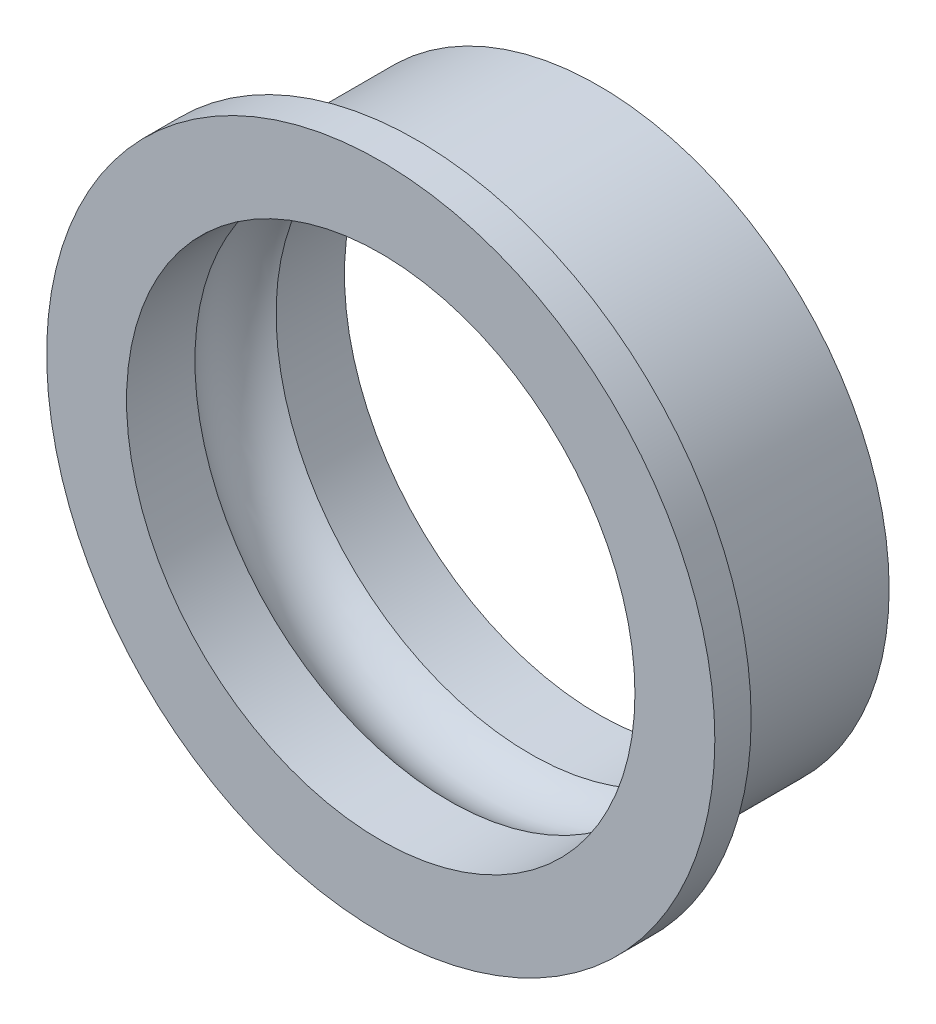
from build123d import *

# Parameters (mm, degrees)
ESQUISSE1_R        = 4
ESQUISSE1_R_2      = 3.5
BOSS_EXTRU_1_DEPTH = 1.5
ESQUISSE2_R        = 4.6
ESQUISSE2_R_2      = 4
BOSS_EXTRU_2_DEPTH = 0.5


with BuildPart() as part:
    # Esquisse1 → Boss.-Extru.1 (new, symmetric)
    with BuildSketch(Plane.XY):
        Circle(ESQUISSE1_R)
        Circle(ESQUISSE1_R_2, mode=Mode.SUBTRACT)
    extrude(amount=BOSS_EXTRU_1_DEPTH, both=True)

    # Esquisse2 → Boss.-Extru.2 (add)
    with BuildSketch(Plane.XY.offset(1.5)):
        Circle(ESQUISSE2_R)
        Circle(ESQUISSE2_R_2, mode=Mode.SUBTRACT)
    extrude(amount=-BOSS_EXTRU_2_DEPTH)

    # Esquisse3 → Enlèvement de matière-Révolution1 (revolve, cut)
    with BuildSketch(Plane(origin=(0, 0, 0), x_dir=(1, 0, 0), z_dir=(0, 1, 0)), mode=Mode.PRIVATE) as enl_vement_de_mati_re_r_volution1_sk:
        with BuildLine():
            Line((-3.5, -0.559016994), (-3.5, 0.559016994))
            ThreePointArc((-3.5, 0.559016994), (-3.75, 0), (-3.5, -0.559016994))
        make_face()
    revolve(enl_vement_de_mati_re_r_volution1_sk.sketch.rotate(Axis((0, 0, 1.5), (0, 0, -1)), 180), axis=Axis((0, 0, 1.5), (0, 0, -1)), mode=Mode.SUBTRACT)


solid = part.part
